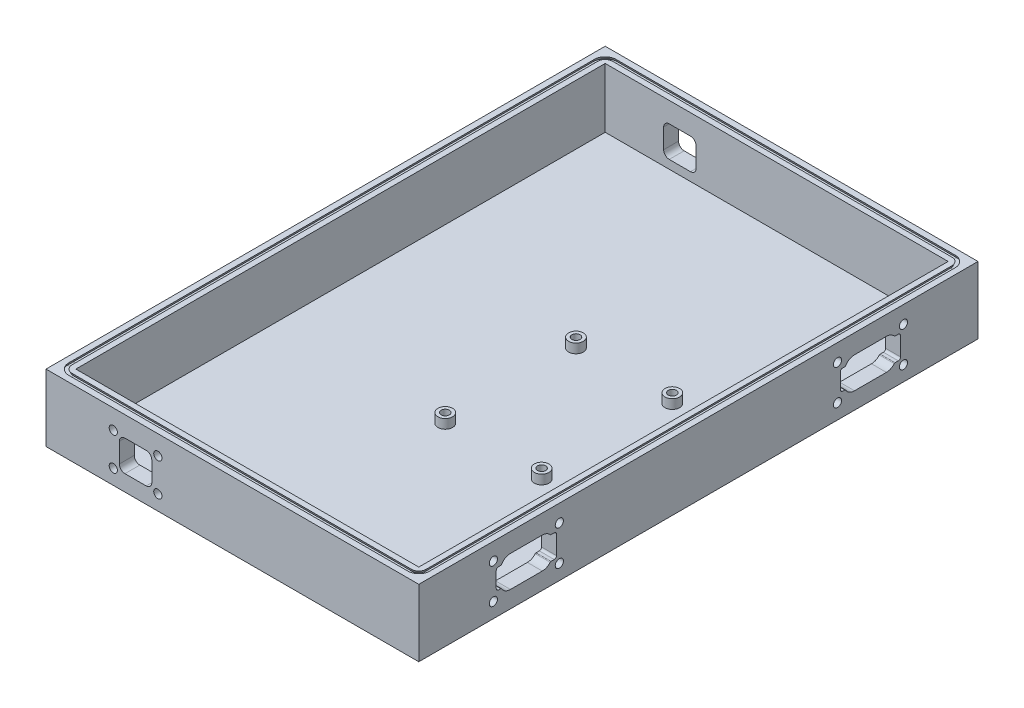
from build123d import *

# Parameters (mm, degrees)
SKETCH1_W           = 254
SKETCH1_H           = 381
BOSS_EXTRUDE1_DEPTH = 45.72
SKETCH2_W           = 233.68
SKETCH2_H           = 360.68
CUT_EXTRUDE1_DEPTH  = 40.64
CUT_EXTRUDE10_REACH = 462.182
F_12_PIN_MOUNT_R    = 2.7999944
CUT_EXTRUDE3_DEPTH  = 5.499989
CUT_EXTRUDE5_REACH  = 462.182
CUT_EXTRUDE6_START  = -381
CUT_EXTRUDE6_DEPTH  = 10.16
SKETCH6_R           = 2.7999944
CUT_EXTRUDE7_DEPTH  = 5.499989
CUT_EXTRUDE8_START  = -375.500011
SKETCH6_2_R         = 2.7999944
CUT_EXTRUDE8_DEPTH  = 5.499989
SKETCH7_R           = 5
BOSS_EXTRUDE2_DEPTH = 6.35
CUT_EXTRUDE9_START  = 6.35
SKETCH8_R           = 2.7999944
CUT_EXTRUDE9_DEPTH  = 5.499989


with BuildPart() as part:
    # Sketch1 → Boss-Extrude1 (new body)
    with BuildSketch(Plane(origin=(0, 0, 0), x_dir=(1, 0, 0), z_dir=(0, 1, 0))):
        with Locations((127, 190.5)):
            Rectangle(SKETCH1_W, SKETCH1_H)
    extrude(amount=BOSS_EXTRUDE1_DEPTH)

    # Sketch2 → Cut-Extrude1 (cut)
    with BuildSketch(Plane(origin=(0, 45.72, 0), x_dir=(1, 0, 0), z_dir=(0, 1, 0))):
        with Locations((127, 190.5)):
            Rectangle(SKETCH2_W, SKETCH2_H)
    extrude(amount=-CUT_EXTRUDE1_DEPTH, mode=Mode.SUBTRACT)

    # Cut-Sweep2: sweep along a path in Sketch3
    with BuildLine(Plane(origin=(0, 45.72, 0), x_dir=(1, 0, 0), z_dir=(0, 1, 0))) as cut_sweep2_path:
        Line((6.35, 11.43), (6.35, 369.57))
        ThreePointArc((6.35, 369.57), (7.837897552, 373.162102448), (11.43, 374.65))
        Line((11.43, 374.65), (242.57, 374.65))
        ThreePointArc((242.57, 374.65), (246.162102448, 373.162102448), (247.65, 369.57))
        Line((247.65, 369.57), (247.65, 11.43))
        ThreePointArc((247.65, 11.43), (246.162102448, 7.837897552), (242.57, 6.35))
        Line((242.57, 6.35), (11.43, 6.35))
        ThreePointArc((11.43, 6.35), (7.837897552, 7.837897552), (6.35, 11.43))
    # Sketch4 → Cut-Sweep2 (sweep, cut)
    with BuildSketch(Plane.XY.offset(-15.24)):
        Polygon((4.064, 45.72), (3.272383398, 43.942), (7.141616602, 43.942), (6.35, 45.72), align=None)
    sweep(path=cut_sweep2_path.line, mode=Mode.SUBTRACT)

    # Sketch13 → Cut-Extrude10 (cut, up to next)
    with BuildSketch(Plane(origin=(254, 0, 0), x_dir=(0, 0, -1), z_dir=(1, 0, 0)), mode=Mode.PRIVATE) as cut_extrude10_sk1:
        with BuildLine():
            Line((55.735714122, 28.956), (54.2925, 28.956))
            ThreePointArc((54.2925, 28.956), (53.214869265, 28.509630735), (52.7685, 27.432))
            Line((52.7685, 27.432), (52.7685, 16.764))
            ThreePointArc((52.7685, 16.764), (53.214869265, 15.686369265), (54.2925, 15.24))
            Line((54.2925, 15.24), (55.735714122, 15.24))
            ThreePointArc((55.735714122, 15.24), (56.109218307, 15.142182673), (56.386829629, 14.873844156))
            ThreePointArc((56.386829629, 14.873844156), (58.959361214, 12.387240562), (62.4205, 11.4808))
            Line((62.4205, 11.4808), (84.1375, 11.4808))
            ThreePointArc((84.1375, 11.4808), (87.094150798, 12.129608753), (89.507465925, 13.956805195))
            ThreePointArc((89.507465925, 13.956805195), (89.767895615, 14.153984667), (90.086958651, 14.224))
            Line((90.086958651, 14.224), (92.2655, 14.224))
            ThreePointArc((92.2655, 14.224), (93.343130735, 14.670369265), (93.7895, 15.748))
            Line((93.7895, 15.748), (93.7895, 28.448))
            ThreePointArc((93.7895, 28.448), (93.343130735, 29.525630735), (92.2655, 29.972))
            Line((92.2655, 29.972), (90.086958651, 29.972))
            ThreePointArc((90.086958651, 29.972), (89.767895615, 30.042015333), (89.507465925, 30.239194805))
            ThreePointArc((89.507465925, 30.239194805), (87.094150798, 32.066391247), (84.1375, 32.7152))
            Line((84.1375, 32.7152), (62.4205, 32.7152))
            ThreePointArc((62.4205, 32.7152), (58.959361214, 31.808759438), (56.386829629, 29.322155844))
            ThreePointArc((56.386829629, 29.322155844), (56.109218307, 29.053817327), (55.735714122, 28.956))
        make_face()
    cut_extrude10_tool1 = extrude(cut_extrude10_sk1.sketch, amount=-CUT_EXTRUDE10_REACH, mode=Mode.PRIVATE) & part.part
    # Sketch13 → Cut-Extrude10 (cut, up to next)
    with BuildSketch(Plane(origin=(254, 0, 0), x_dir=(0, 0, -1), z_dir=(1, 0, 0)), mode=Mode.PRIVATE) as cut_extrude10_sk2:
        with BuildLine():
            Line((290.177714122, 28.956), (288.7345, 28.956))
            ThreePointArc((288.7345, 28.956), (287.656869265, 28.509630735), (287.2105, 27.432))
            Line((287.2105, 27.432), (287.2105, 16.764))
            ThreePointArc((287.2105, 16.764), (287.656869265, 15.686369265), (288.7345, 15.24))
            Line((288.7345, 15.24), (290.177714122, 15.24))
            ThreePointArc((290.177714122, 15.24), (290.551218307, 15.142182673), (290.828829629, 14.873844156))
            ThreePointArc((290.828829629, 14.873844156), (293.401361214, 12.387240562), (296.8625, 11.4808))
            Line((296.8625, 11.4808), (318.5795, 11.4808))
            ThreePointArc((318.5795, 11.4808), (321.536150798, 12.129608753), (323.949465925, 13.956805195))
            ThreePointArc((323.949465925, 13.956805195), (324.209895615, 14.153984667), (324.528958651, 14.224))
            Line((324.528958651, 14.224), (326.7075, 14.224))
            ThreePointArc((326.7075, 14.224), (327.785130735, 14.670369265), (328.2315, 15.748))
            Line((328.2315, 15.748), (328.2315, 28.448))
            ThreePointArc((328.2315, 28.448), (327.785130735, 29.525630735), (326.7075, 29.972))
            Line((326.7075, 29.972), (324.528958651, 29.972))
            ThreePointArc((324.528958651, 29.972), (324.209895615, 30.042015333), (323.949465925, 30.239194805))
            ThreePointArc((323.949465925, 30.239194805), (321.536150798, 32.066391247), (318.5795, 32.7152))
            Line((318.5795, 32.7152), (296.8625, 32.7152))
            ThreePointArc((296.8625, 32.7152), (293.401361214, 31.808759438), (290.828829629, 29.322155844))
            ThreePointArc((290.828829629, 29.322155844), (290.551218307, 29.053817327), (290.177714122, 28.956))
        make_face()
    cut_extrude10_tool2 = extrude(cut_extrude10_sk2.sketch, amount=-CUT_EXTRUDE10_REACH, mode=Mode.PRIVATE) & part.part
    add(cut_extrude10_tool1.solids().sort_by_distance((254, 22.098, -73.454803))[0], mode=Mode.SUBTRACT)
    add(cut_extrude10_tool2.solids().sort_by_distance((254, 22.098, -307.896803))[0], mode=Mode.SUBTRACT)

    # 12 pin mount → Cut-Extrude3 (cut)
    with BuildSketch(Plane(origin=(254, 0, 0), x_dir=(0, 0, -1), z_dir=(1, 0, 0))):
        with Locations((95.758, 34.036)):
            Circle(F_12_PIN_MOUNT_R)
        with Locations((95.758, 10.16)):
            Circle(F_12_PIN_MOUNT_R)
        with Locations((50.8, 10.16)):
            Circle(F_12_PIN_MOUNT_R)
        with Locations((50.8, 34.036)):
            Circle(F_12_PIN_MOUNT_R)
        with Locations((285.242, 34.036)):
            Circle(F_12_PIN_MOUNT_R)
        with Locations((330.2, 34.036)):
            Circle(F_12_PIN_MOUNT_R)
        with Locations((330.2, 10.16)):
            Circle(F_12_PIN_MOUNT_R)
        with Locations((285.242, 10.16)):
            Circle(F_12_PIN_MOUNT_R)
    extrude(amount=-CUT_EXTRUDE3_DEPTH, mode=Mode.SUBTRACT)

    # 4 pin connector → Cut-Extrude5 (cut, up to next)
    with BuildSketch(Plane.XY, mode=Mode.PRIVATE) as cut_extrude5_sk1:
        with BuildLine():
            Line((53.7845, 31.877), (68.2625, 31.877))
            ThreePointArc((68.2625, 31.877), (70.956576836, 30.761076836), (72.0725, 28.067))
            Line((72.0725, 28.067), (72.0725, 14.7066))
            ThreePointArc((72.0725, 14.7066), (70.956576836, 12.012523164), (68.2625, 10.8966))
            Line((68.2625, 10.8966), (53.7845, 10.8966))
            ThreePointArc((53.7845, 10.8966), (51.090423164, 12.012523164), (49.9745, 14.7066))
            Line((49.9745, 14.7066), (49.9745, 28.067))
            ThreePointArc((49.9745, 28.067), (51.090423164, 30.761076836), (53.7845, 31.877))
        make_face()
    cut_extrude5_tool1 = extrude(cut_extrude5_sk1.sketch, amount=-CUT_EXTRUDE5_REACH, mode=Mode.PRIVATE) & part.part
    add(cut_extrude5_tool1.solids().sort_by_distance((61.0235, 21.3868, 0))[0], mode=Mode.SUBTRACT)

    # Sketch5<2> → Cut-Extrude6 (cut)
    with BuildSketch(Plane.XY.offset(CUT_EXTRUDE6_START)):
        with BuildLine():
            Line((53.7845, 31.877), (68.2625, 31.877))
            ThreePointArc((68.2625, 31.877), (70.956576836, 30.761076836), (72.0725, 28.067))
            Line((72.0725, 28.067), (72.0725, 14.7066))
            ThreePointArc((72.0725, 14.7066), (70.956576836, 12.012523164), (68.2625, 10.8966))
            Line((68.2625, 10.8966), (53.7845, 10.8966))
            ThreePointArc((53.7845, 10.8966), (51.090423164, 12.012523164), (49.9745, 14.7066))
            Line((49.9745, 14.7066), (49.9745, 28.067))
            ThreePointArc((49.9745, 28.067), (51.090423164, 30.761076836), (53.7845, 31.877))
        make_face()
    extrude(amount=CUT_EXTRUDE6_DEPTH, mode=Mode.SUBTRACT)

    # Sketch6 → Cut-Extrude7 (cut)
    with BuildSketch(Plane.XY):
        with Locations((76.2, 32.6136)):
            Circle(SKETCH6_R)
        with Locations((76.2, 10.16)):
            Circle(SKETCH6_R)
        with Locations((45.847, 10.16)):
            Circle(SKETCH6_R)
        with Locations((45.847, 32.6136)):
            Circle(SKETCH6_R)
    extrude(amount=-CUT_EXTRUDE7_DEPTH, mode=Mode.SUBTRACT)

    # Sketch6<2> → Cut-Extrude8 (cut)
    with BuildSketch(Plane.XY.offset(CUT_EXTRUDE8_START)):
        with Locations((76.2, 32.6136)):
            Circle(SKETCH6_2_R)
        with Locations((76.2, 10.16)):
            Circle(SKETCH6_2_R)
        with Locations((45.847, 10.16)):
            Circle(SKETCH6_2_R)
        with Locations((45.847, 32.6136)):
            Circle(SKETCH6_2_R)
    extrude(amount=-CUT_EXTRUDE8_DEPTH, mode=Mode.SUBTRACT)

    # Sketch7 → Boss-Extrude2 (add)
    with BuildSketch(Plane(origin=(0, 5.08, 0), x_dir=(1, 0, 0), z_dir=(0, 1, 0))):
        with Locations(Location((127.38, 144.673865575, 0), (0, 0, 90))):
            Circle(SKETCH7_R)
        with Locations(Location((193.04, 144.673865575, 0), (0, 0, 90))):
            Circle(SKETCH7_R)
        with Locations(Location((193.04, 233.703865575, 0), (0, 0, 90))):
            Circle(SKETCH7_R)
        with Locations(Location((127.38, 233.703865575, 0), (0, 0, 90))):
            Circle(SKETCH7_R)
    extrude(amount=BOSS_EXTRUDE2_DEPTH)

    # Sketch8 → Cut-Extrude9 (cut)
    with BuildSketch(Plane(origin=(0, 5.08, 0), x_dir=(1, 0, 0), z_dir=(0, 1, 0)).offset(CUT_EXTRUDE9_START)):
        with Locations(Location((127.38, 233.703865575, 0), (0, 0, 270))):
            Circle(SKETCH8_R)
        with Locations(Location((193.04, 233.703865575, 0), (0, 0, 270))):
            Circle(SKETCH8_R)
        with Locations(Location((193.04, 144.673865575, 0), (0, 0, 270))):
            Circle(SKETCH8_R)
        with Locations(Location((127.38, 144.673865575, 0), (0, 0, 270))):
            Circle(SKETCH8_R)
    extrude(amount=-CUT_EXTRUDE9_DEPTH, mode=Mode.SUBTRACT)


solid = part.part
